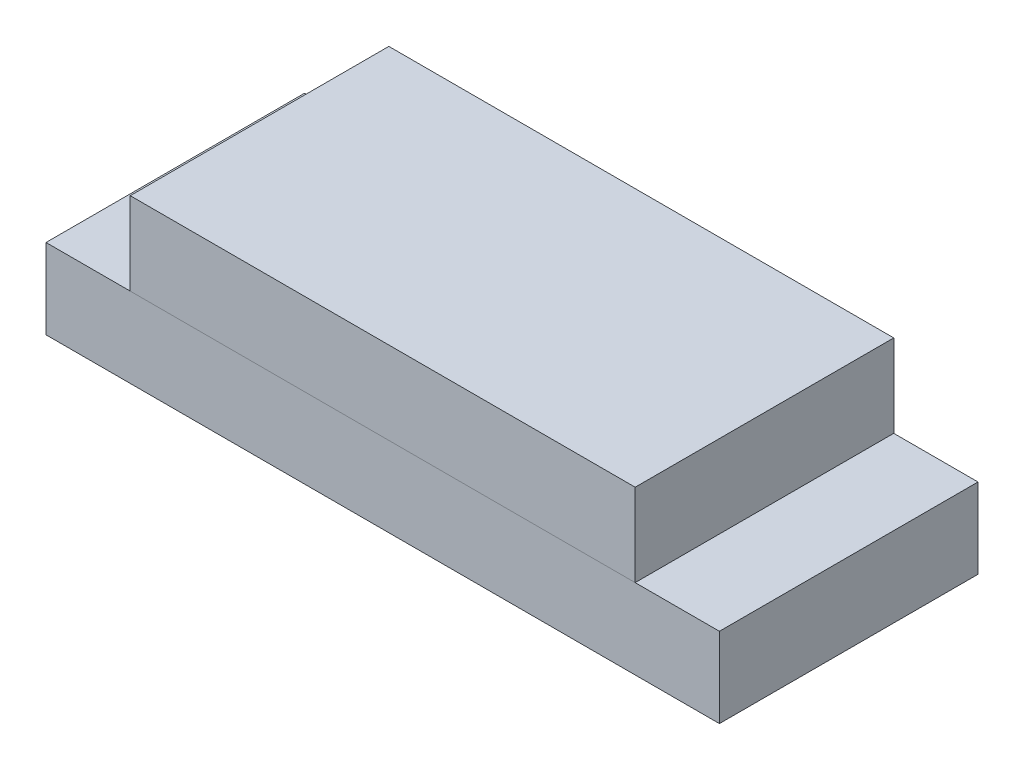
from build123d import *

# Parameters (mm, degrees)
SKETCH1_W           = 64.1604
SKETCH1_H           = 7.62
BOSS_EXTRUDE1_DEPTH = 24.638
SKETCH2_W           = 48.1076
SKETCH2_H           = 7.874
BOSS_EXTRUDE2_DEPTH = 24.638


with BuildPart() as part:
    # Sketch1 → Boss-Extrude1 (new body)
    with BuildSketch(Plane.XY):
        with Locations((32.0802, 3.81)):
            Rectangle(SKETCH1_W, SKETCH1_H)
    extrude(amount=BOSS_EXTRUDE1_DEPTH)


with BuildPart() as body_2:
    # Sketch2 → Boss-Extrude2 (new body)
    with BuildSketch(Plane(origin=(0, 0, 0), x_dir=(-1, 0, 0), z_dir=(0, 0, -1))):
        with Locations((-32.0802, 11.557)):
            Rectangle(SKETCH2_W, SKETCH2_H)
    extrude(amount=-BOSS_EXTRUDE2_DEPTH)


solid = Compound([part.part, body_2.part])
